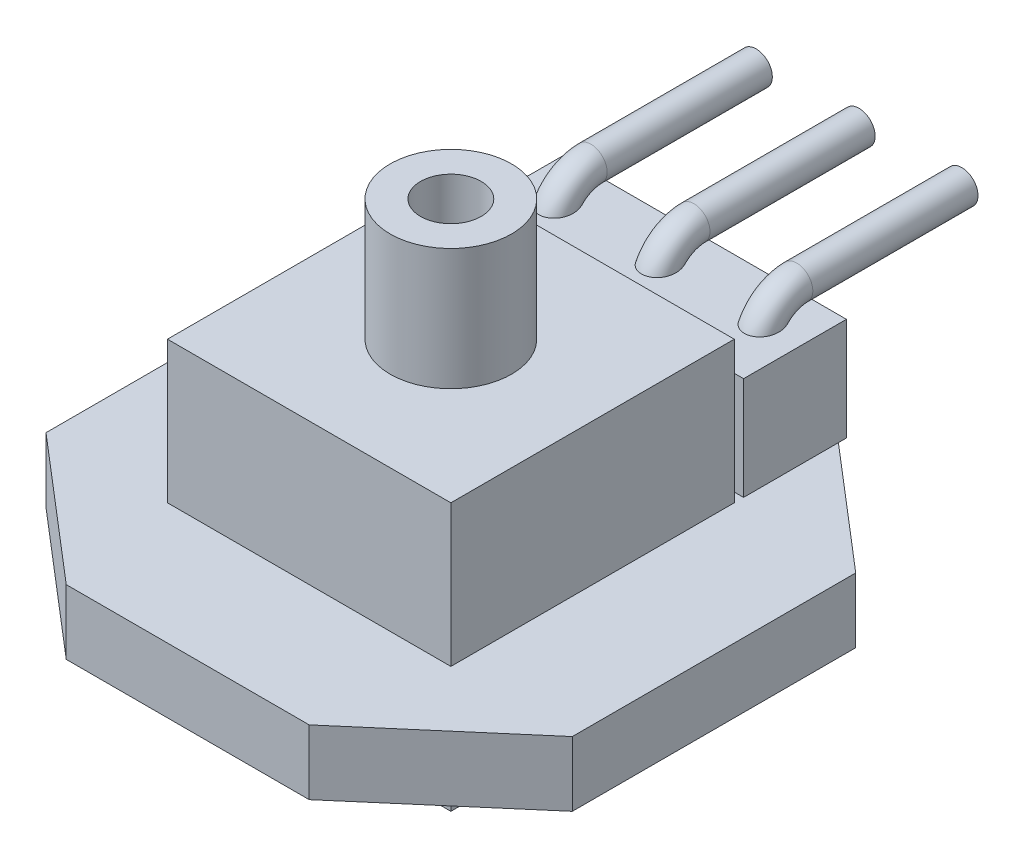
from build123d import *

# Parameters (mm, degrees)
EXTRUDE_362_DEPTH          = 1.6
SKETCH_2_W                 = 7
SKETCH_2_H                 = 7
EXTRUDE_2_DEPTH            = 3.5
SKETCH_3_R                 = 1.5
SKETCH_3_R_2               = 0.75
EXTRUDE_3_DEPTH            = 3
SKETCH_6_W                 = 6
SKETCH_6_H                 = 6
EXTRUDE_6_DEPTH            = 2
SKETCH_4_R                 = 0.4
PATTERN_LINEAR_1_COUNT     = 2
PATTERN_LINEAR_1_PITCH     = 2.54
PATTERN_LINEAR_1_COL_COUNT = 2
PATTERN_LINEAR_1_COL_PITCH = 2.54
SKETCH_8_W                 = 7
SKETCH_8_H                 = 2.54
EXTRUDE_7_DEPTH            = 2.54


with BuildPart() as part:
    # Эскиз1 → Extrude 362 (new body)
    with BuildSketch(Plane(origin=(0, 0, 0), x_dir=(1, 0, 0), z_dir=(0, 1, 0))):
        Polygon((-3, 6.5), (3, 6.5), (6.5, 3.5), (6.5, -3.5), (3, -6.5), (-3, -6.5), (-6.5, -3.5), (-6.5, 3.5), align=None)
    extrude(amount=EXTRUDE_362_DEPTH)

    # Эскиз2 → Бобышка-Вытянуть2 (add)
    with BuildSketch(Plane(origin=(0, 1.6, 0), x_dir=(1, 0, 0), z_dir=(0, 1, 0))):
        Rectangle(SKETCH_2_W, SKETCH_2_H)
    extrude(amount=EXTRUDE_2_DEPTH)

    # Эскиз3 → Бобышка-Вытянуть3 (add)
    with BuildSketch(Plane(origin=(0, 5.1, 0), x_dir=(1, 0, 0), z_dir=(0, 1, 0))):
        with Locations(Location((0, 0, 0), (0, 0, 270))):
            Circle(SKETCH_3_R)
        with Locations(Location((0, 0, 0), (0, 0, 270))):
            Circle(SKETCH_3_R_2, mode=Mode.SUBTRACT)
    extrude(amount=EXTRUDE_3_DEPTH)

    # Эскиз6 → Бобышка-Вытянуть6 (add)
    with BuildSketch(Plane.XZ):
        Rectangle(SKETCH_6_W, SKETCH_6_H)
    extrude(amount=EXTRUDE_6_DEPTH)

    # По траектории1: sweep along a path in Эскиз7
    with BuildLine(Plane(origin=(0, 0, 0), x_dir=(0, 0, -1), z_dir=(1, 0, 0))) as sweep_1_path:
        Line((5, 1.6), (5, 3.6))
        ThreePointArc((5, 3.6), (5.292893219, 4.307106781), (6, 4.6))
        Line((6, 4.6), (10.08, 4.6))
    # Эскиз4 → По траектории1 (sweep)
    with BuildSketch(Plane.XZ.offset(-1.6)):
        with Locations((0, -5)):
            Circle(SKETCH_4_R)
    sweep_1 = sweep(path=sweep_1_path.line)

    # Линейный массив1: По траектории1 ×2
    with Locations(*[(i * PATTERN_LINEAR_1_PITCH, 0, 0) for i in range(1, PATTERN_LINEAR_1_COUNT)]):
        add(sweep_1)

    # Линейный массив1 col: По траектории1 ×2
    with Locations(*[(-i * PATTERN_LINEAR_1_COL_PITCH, 0, 0) for i in range(1, PATTERN_LINEAR_1_COL_COUNT)]):
        add(sweep_1)

    # Эскиз8 → Бобышка-Вытянуть7 (add)
    with BuildSketch(Plane(origin=(0, 1.6, 0), x_dir=(1, 0, 0), z_dir=(0, 1, 0))):
        with Locations((0, 5)):
            Rectangle(SKETCH_8_W, SKETCH_8_H)
    extrude(amount=EXTRUDE_7_DEPTH)


solid = part.part
